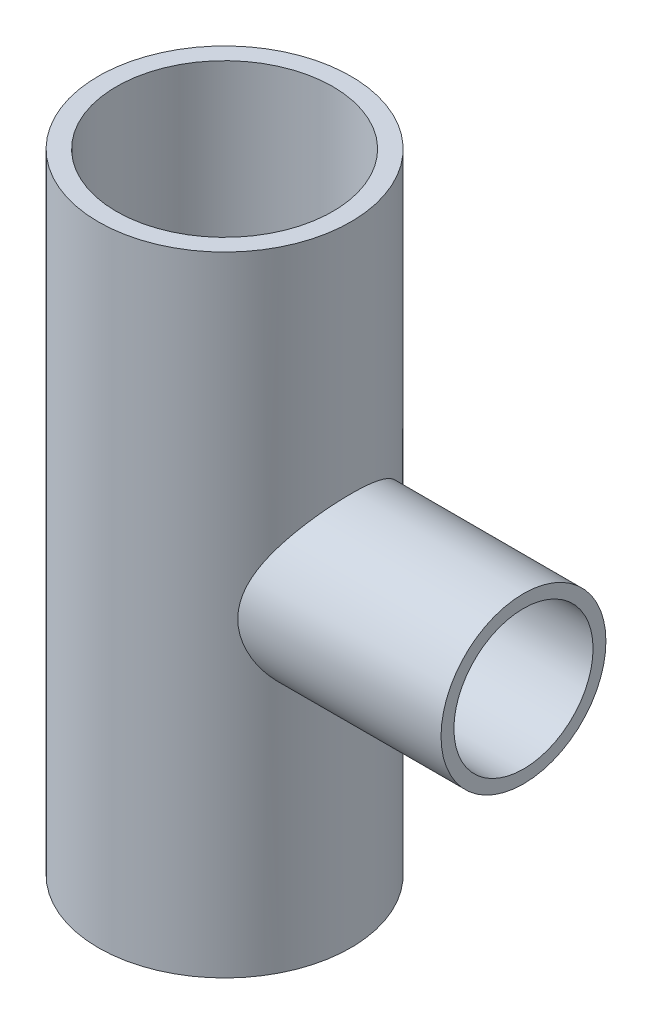
from build123d import *

# Parameters (mm, degrees)
SKETCH1_R           = 24.5
SKETCH1_R_2         = 21
SKETCH5_R           = 16
SKETCH5_R_2         = 13.5
BOSS_EXTRUDE3_DEPTH = 58


with BuildPart() as part:
    # Sweep2: sweep along a path in Sketch2
    with BuildLine(Plane.XY) as sweep2_path:
        Line((0, 0), (0, 122))
    # Sketch1 → Sweep2 (sweep)
    with BuildSketch(Plane(origin=(0, 0, 0), x_dir=(1, 0, 0), z_dir=(0, 1, 0))):
        Circle(SKETCH1_R)
        Circle(SKETCH1_R_2, mode=Mode.SUBTRACT)
    sweep(path=sweep2_path.line)

    # Sketch5 → Boss-Extrude3 (add)
    with BuildSketch(Plane(origin=(0, 0, 0), x_dir=(0, 0, -1), z_dir=(1, 0, 0))):
        with Locations(Location((0, 60.289677485, 0), (0, 0, 180))):
            Circle(SKETCH5_R)
        with Locations(Location((0, 60.289677485, 0), (0, 0, 180))):
            Circle(SKETCH5_R_2, mode=Mode.SUBTRACT)
    extrude(amount=BOSS_EXTRUDE3_DEPTH)


solid = part.part
